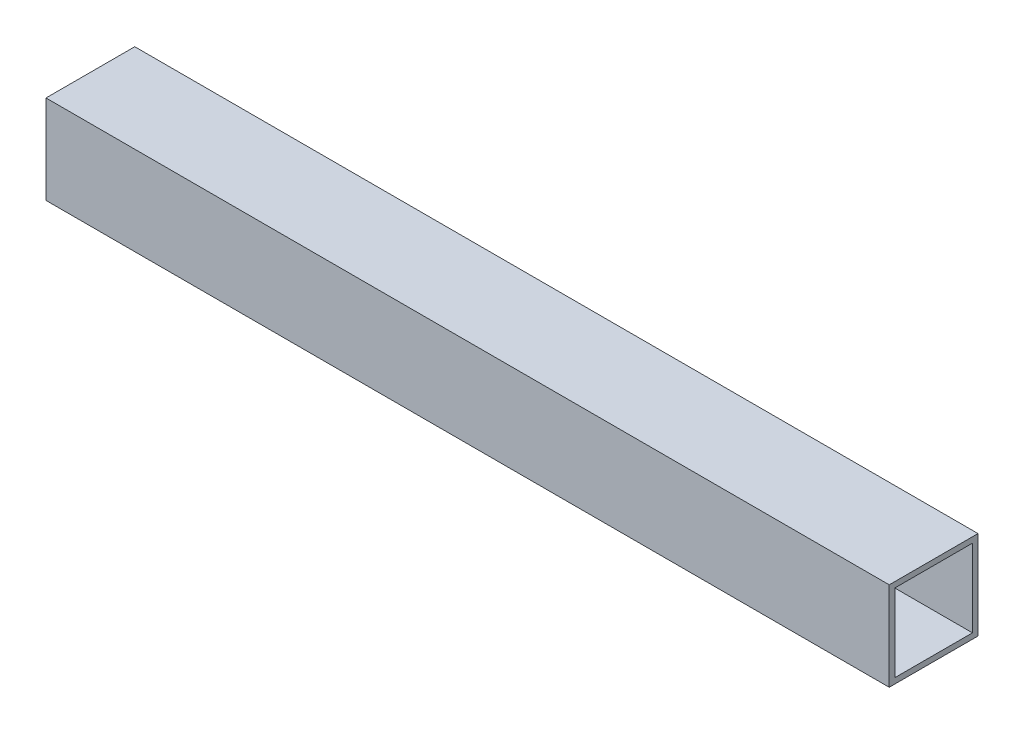
from build123d import *

# Parameters (mm, degrees)
CROQUIS2_W           = 50.8
CROQUIS2_H           = 50.8
CROQUIS2_W_2         = 44.45
CROQUIS2_H_2         = 44.45
EXTRUCI_N_BASE_DEPTH = 241.3


with BuildPart() as part:
    # Croquis2 → Extrución Base (new, symmetric)
    with BuildSketch(Plane(origin=(0, 0, 0), x_dir=(0, 0, -1), z_dir=(1, 0, 0))):
        Rectangle(CROQUIS2_W, CROQUIS2_H)
        Rectangle(CROQUIS2_W_2, CROQUIS2_H_2, mode=Mode.SUBTRACT)
    extrude(amount=EXTRUCI_N_BASE_DEPTH, both=True)


solid = part.part
